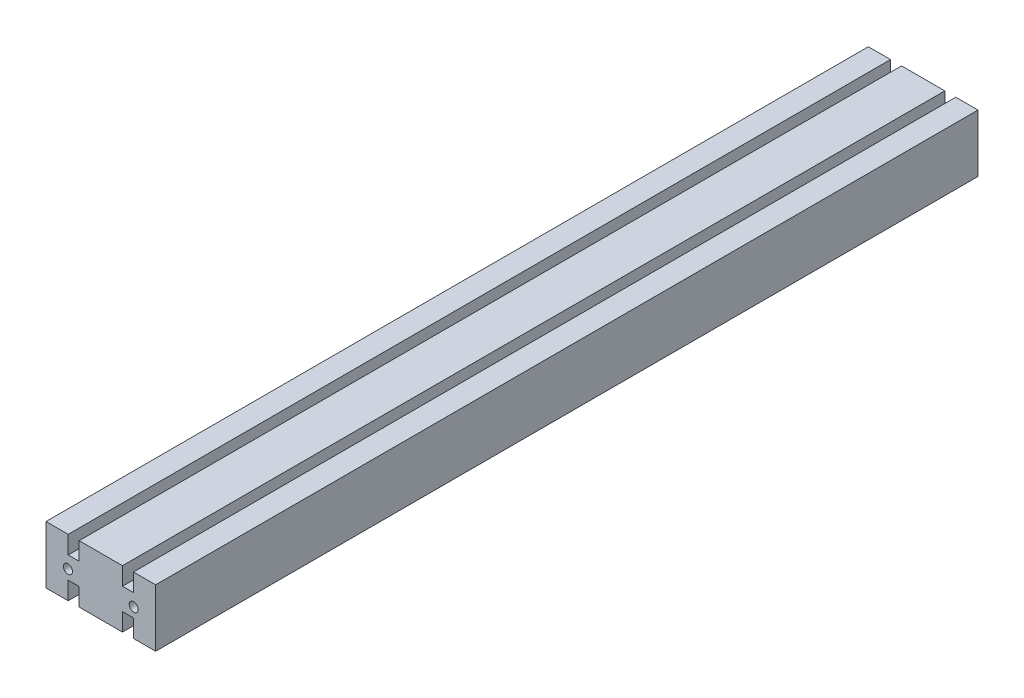
from build123d import *

# Parameters (mm, degrees)
SKETCH1_W                 = 40
SKETCH1_H                 = 21
BOSS_EXTRUDE1_DEPTH       = 150
CUT_EXTRUDE1_DEPTH        = 152.691298366
CUT_EXTRUDE1_DEPTH_BACK   = 152.691298366
SKETCH2_W                 = 4
SKETCH2_H                 = 6.5
M4X0_7_TAPPED_HOLE1_D     = 3.3
M4X0_7_TAPPED_HOLE1_DEPTH = 10.1
M4X0_7_TAPPED_HOLE1_TIP   = 0.991420021
M4X0_7_TAPPED_HOLE2_D     = 3.3
M4X0_7_TAPPED_HOLE2_DEPTH = 10.1
M4X0_7_TAPPED_HOLE2_TIP   = 0.991420021


with BuildPart() as part:
    # Sketch1 → Boss-Extrude1 (new, symmetric)
    with BuildSketch(Plane.XY):
        Rectangle(SKETCH1_W, SKETCH1_H)
    extrude(amount=BOSS_EXTRUDE1_DEPTH, both=True)

    # Sketch2 → Cut-Extrude1 (cut, two sides: drawn at the far end of the back side and taken through both)
    with BuildSketch(Plane.XY.offset(-CUT_EXTRUDE1_DEPTH_BACK)):
        with Locations((9.9, 7.25)):
            Rectangle(SKETCH2_W, SKETCH2_H)
        with Locations((-9.9, 7.25)):
            Rectangle(SKETCH2_W, SKETCH2_H)
        with Locations((9.9, -7.25)):
            Rectangle(SKETCH2_W, SKETCH2_H)
        with Locations((-9.9, -7.25)):
            Rectangle(SKETCH2_W, SKETCH2_H)
    extrude(amount=CUT_EXTRUDE1_DEPTH + CUT_EXTRUDE1_DEPTH_BACK, mode=Mode.SUBTRACT)

    # M4x0.7 Tapped Hole1
    with Locations(Plane.XY.offset(150)):
        with Locations((-12, -0.5), (12, -0.5)):
            Hole(M4X0_7_TAPPED_HOLE1_D / 2, depth=M4X0_7_TAPPED_HOLE1_DEPTH)
            with Locations((0, 0, -(M4X0_7_TAPPED_HOLE1_DEPTH + M4X0_7_TAPPED_HOLE1_TIP / 2))):  # 118° drill point
                Cone(0, M4X0_7_TAPPED_HOLE1_D / 2, M4X0_7_TAPPED_HOLE1_TIP, mode=Mode.SUBTRACT)

    # M4x0.7 Tapped Hole2
    with Locations(Plane(origin=(0, 0, -150), x_dir=(-1, 0, 0), z_dir=(0, 0, -1))):
        with Locations((-12, -0.5), (12, -0.5)):
            Hole(M4X0_7_TAPPED_HOLE2_D / 2, depth=M4X0_7_TAPPED_HOLE2_DEPTH)
            with Locations((0, 0, -(M4X0_7_TAPPED_HOLE2_DEPTH + M4X0_7_TAPPED_HOLE2_TIP / 2))):  # 118° drill point
                Cone(0, M4X0_7_TAPPED_HOLE2_D / 2, M4X0_7_TAPPED_HOLE2_TIP, mode=Mode.SUBTRACT)


solid = part.part
